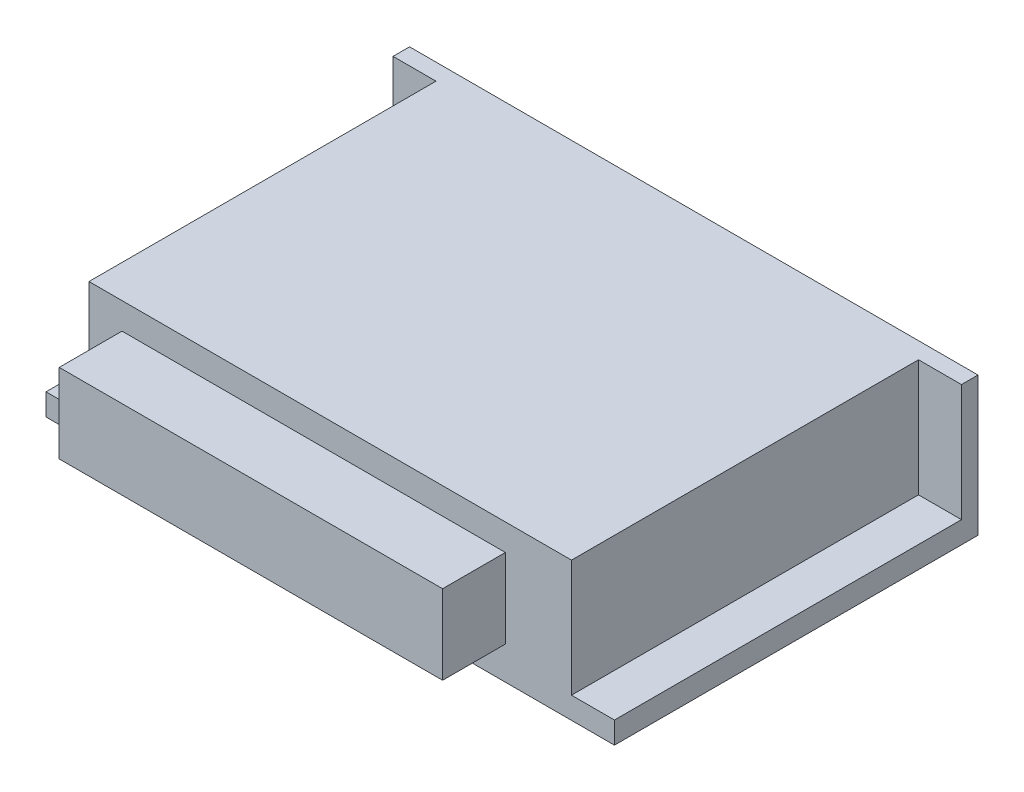
from build123d import *

# Parameters (mm, degrees)
SKETCH1_W           = 86
SKETCH1_H           = 55
BOSS_EXTRUDE1_DEPTH = 3.3
BOSS_EXTRUDE2_DEPTH = 17.7
SKETCH3_W           = 58
SKETCH3_H           = 12
BOSS_EXTRUDE3_DEPTH = 9.5


with BuildPart() as part:
    # Sketch1 → Boss-Extrude1 (new body)
    with BuildSketch(Plane(origin=(0, 0, 0), x_dir=(1, 0, 0), z_dir=(0, 1, 0))):
        Rectangle(SKETCH1_W, SKETCH1_H)
    extrude(amount=BOSS_EXTRUDE1_DEPTH)

    # Sketch2 → Boss-Extrude2 (add)
    with BuildSketch(Plane(origin=(0, 3.3, 0), x_dir=(1, 0, 0), z_dir=(0, 1, 0))):
        Polygon((43, 27.5), (-43, 27.5), (-43, 25), (-36.5, 25), (-36.5, -27.5), (36.5, -27.5), (36.5, 25), (43, 25), align=None)
    extrude(amount=BOSS_EXTRUDE2_DEPTH)

    # Sketch3 → Boss-Extrude3 (add)
    with BuildSketch(Plane.XY.offset(27.5)):
        with Locations((-2.5, 11)):
            Rectangle(SKETCH3_W, SKETCH3_H)
    extrude(amount=BOSS_EXTRUDE3_DEPTH)


solid = part.part
